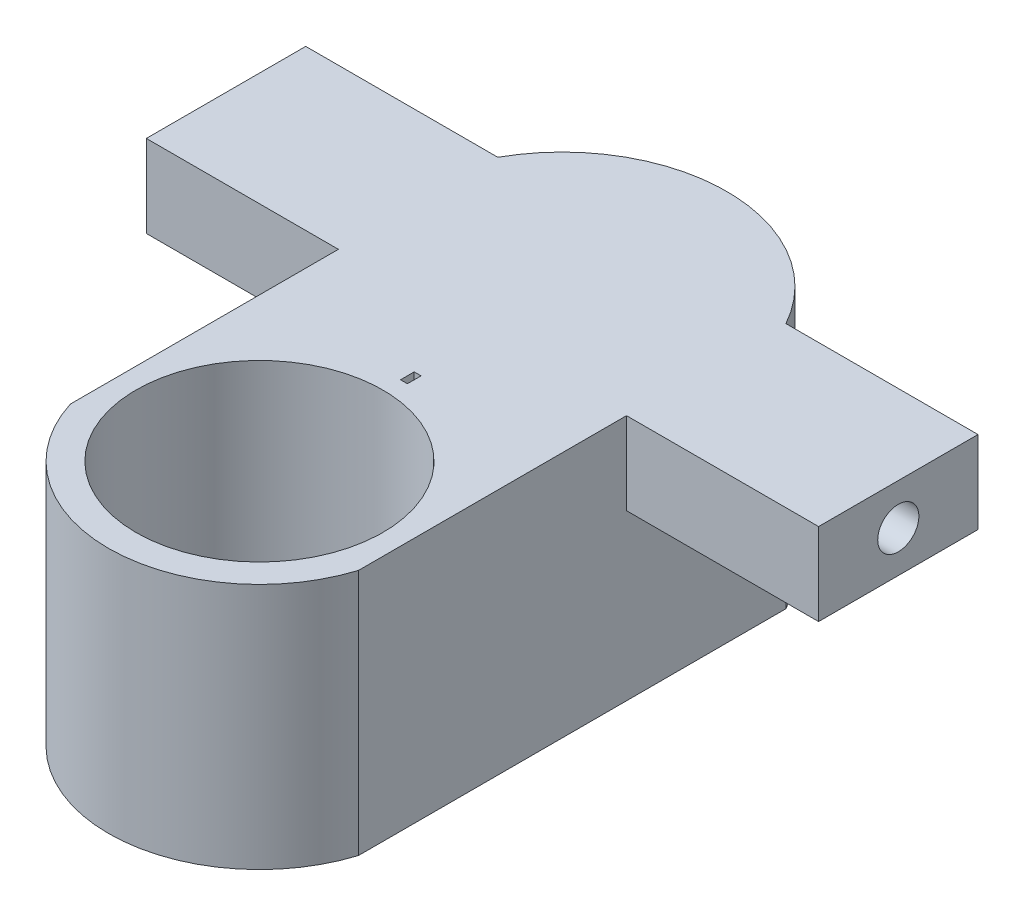
from build123d import *

# Parameters (mm, degrees)
SKETCH1_W           = 21
SKETCH1_H           = 45.065175024
BOSS_EXTRUDE1_DEPTH = 18
SKETCH6_R           = 9
CUT_EXTRUDE4_DEPTH  = 52
CUT_EXTRUDE5_DEPTH  = 52
SKETCH10_W          = 5.809475019
SKETCH10_H          = 6
BOSS_EXTRUDE2_DEPTH = 14
SKETCH11_W          = 0.5
SKETCH11_H          = 1
CUT_EXTRUDE6_DEPTH  = 0.5
CUT_EXTRUDE7_DEPTH  = 10


with BuildPart() as part:
    # Sketch1 → Boss-Extrude1 (new body)
    with BuildSketch(Plane(origin=(0, 0, 0), x_dir=(1, 0, 0), z_dir=(0, 1, 0))):
        with Locations((0, -10.532587512)):
            Rectangle(SKETCH1_W, SKETCH1_H)
    extrude(amount=BOSS_EXTRUDE1_DEPTH)

    # Sketch6 → Cut-Extrude4 (cut)
    with BuildSketch(Plane(origin=(0, 18, 0), x_dir=(1, 0, 0), z_dir=(0, 1, 0))):
        with BuildLine():
            Line((0, -33.065175024), (10.5, -33.065175024))
            Line((10.5, -33.065175024), (10.5, -25.343894287))
            ThreePointArc((10.5, -25.343894287), (6.51667431, -30.927057214), (0, -33.065175024))
        make_face()
        with Locations(Location((0, -22.065175024, 0), (0, 0, 270))):
            Circle(SKETCH6_R)
        with BuildLine():
            Line((-10.5, -33.065175024), (0, -33.065175024))
            ThreePointArc((0, -33.065175024), (-6.51667431, -30.927057214), (-10.5, -25.343894287))
            Line((-10.5, -25.343894287), (-10.5, -33.065175024))
        make_face()
    extrude(amount=-CUT_EXTRUDE4_DEPTH, mode=Mode.SUBTRACT)

    # Sketch8 → Cut-Extrude5 (cut)
    with BuildSketch(Plane(origin=(0, 18, 0), x_dir=(1, 0, 0), z_dir=(0, 1, 0))):
        with BuildLine():
            Line((0, 12), (-10.5, 12))
            Line((-10.5, 12), (-10.5, 5.809475019))
            ThreePointArc((-10.5, 5.809475019), (-6.094518019, 10.337158706), (0, 12))
        make_face()
        with BuildLine():
            Line((10.5, 12), (0, 12))
            ThreePointArc((0, 12), (6.094518019, 10.337158706), (10.5, 5.809475019))
            Line((10.5, 5.809475019), (10.5, 12))
        make_face()
    extrude(amount=-CUT_EXTRUDE5_DEPTH, mode=Mode.SUBTRACT)

    # Sketch10 → Boss-Extrude2 (add)
    with BuildSketch(Plane.ZY.offset(10.5)):
        with Locations((2.90473751, 15)):
            Rectangle(SKETCH10_W, SKETCH10_H)
        with Locations((-2.90473751, 15)):
            Rectangle(SKETCH10_W, SKETCH10_H)
    boss_extrude2 = extrude(amount=BOSS_EXTRUDE2_DEPTH)

    # Sketch11 → Cut-Extrude6 (cut)
    with BuildSketch(Plane(origin=(0, 18, 0), x_dir=(1, 0, 0), z_dir=(0, 1, 0))):
        with Locations((0.25, -11.282587512)):
            Rectangle(SKETCH11_W, SKETCH11_H)
    extrude(amount=-CUT_EXTRUDE6_DEPTH, mode=Mode.SUBTRACT)

    # Mirror1: Boss-Extrude2 across plane
    add(boss_extrude2.mirror(Plane(origin=(0, 17.5, 0), x_dir=(0, 0, 1), z_dir=(-1, 0, 0))))

    # Sketch12 → Cut-Extrude7 (cut)
    with BuildSketch(Plane.ZY.offset(24.5)):
        with BuildLine():
            ThreePointArc((1.5, 15), (1.060660172, 16.060660172), (0, 16.5))
            Line((0, 16.5), (0, 13.5))
            ThreePointArc((0, 13.5), (1.060660172, 13.939339828), (1.5, 15))
        make_face()
        with BuildLine():
            Line((0, 13.5), (0, 16.5))
            ThreePointArc((0, 16.5), (-1.5, 15), (0, 13.5))
        make_face()
    cut_extrude7 = extrude(amount=-CUT_EXTRUDE7_DEPTH, mode=Mode.SUBTRACT)

    # Mirror2: Cut-Extrude7 across plane
    add(cut_extrude7.mirror(Plane(origin=(0, 17.5, 0), x_dir=(0, 0, 1), z_dir=(-1, 0, 0))), mode=Mode.SUBTRACT)


solid = part.part
